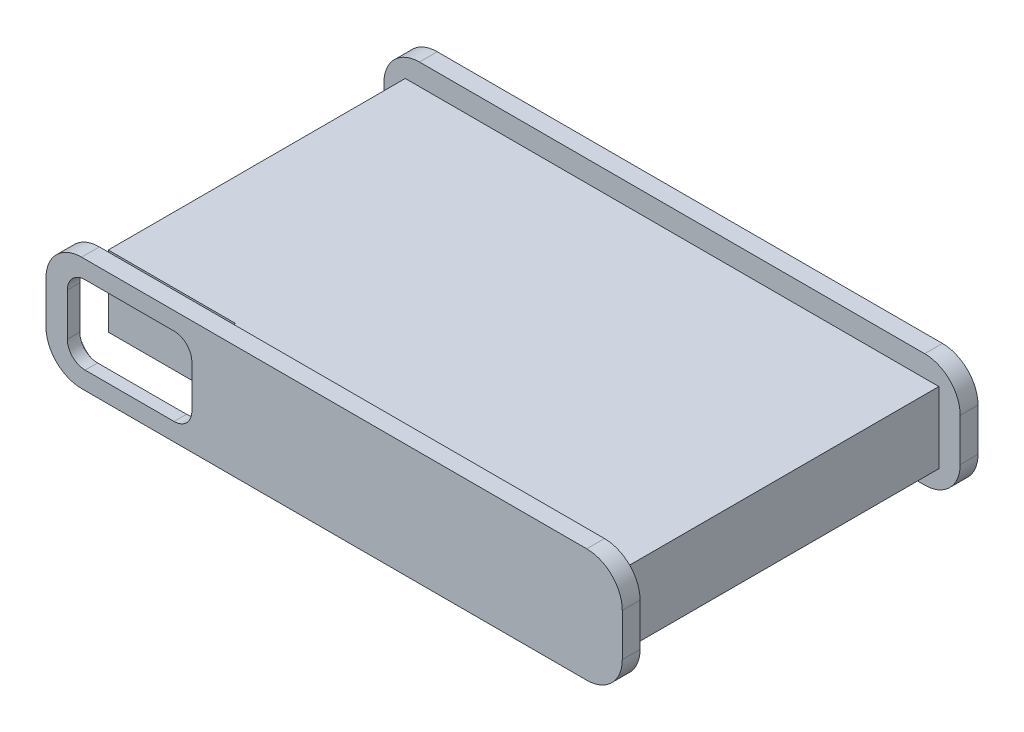
from build123d import *

# Parameters (mm, degrees)
SKETCH1_W           = 150
SKETCH1_H           = 20
BOSS_EXTRUDE1_DEPTH = 90
SKETCH2_W           = 162
SKETCH2_H           = 32
BOSS_EXTRUDE2_DEPTH = 5
FILLET1_R           = 10
FILLET2_R           = 10
FILLET3_R           = 10
FILLET4_R           = 10
BOSS_EXTRUDE3_DEPTH = 5
CUT_EXTRUDE1_DEPTH  = 3.5
CUT_EXTRUDE2_DEPTH  = 8


with BuildPart() as part:
    # Sketch1 → Boss-Extrude1 (new body)
    with BuildSketch(Plane.XY):
        Rectangle(SKETCH1_W, SKETCH1_H)
    extrude(amount=BOSS_EXTRUDE1_DEPTH)

    # Sketch2 → Boss-Extrude2 (add)
    with BuildSketch(Plane(origin=(0, 0, 0), x_dir=(-1, 0, 0), z_dir=(0, 0, -1))):
        Rectangle(SKETCH2_W, SKETCH2_H)
    extrude(amount=BOSS_EXTRUDE2_DEPTH)

    # Fillet1
    fillet1_edges = [part.edges().sort_by_distance(p)[0] for p in [
        (81, 16, -2.5),
    ]]
    fillet(fillet1_edges, radius=FILLET1_R)

    # Fillet2
    fillet2_edges = [part.edges().sort_by_distance(p)[0] for p in [
        (81, -16, -2.5),
    ]]
    fillet(fillet2_edges, radius=FILLET2_R)

    # Fillet3
    fillet3_edges = [part.edges().sort_by_distance(p)[0] for p in [
        (-81, 16, -2.5),
    ]]
    fillet(fillet3_edges, radius=FILLET3_R)

    # Fillet4
    fillet4_edges = [part.edges().sort_by_distance(p)[0] for p in [
        (-81, -16, -2.5),
    ]]
    fillet(fillet4_edges, radius=FILLET4_R)

    # Sketch3 → Boss-Extrude3 (add)
    with BuildSketch(Plane.XY.offset(90)):
        with BuildLine():
            Line((-81, 6), (-81, -6))
            ThreePointArc((-81, -6), (-78.071067812, -13.071067812), (-71, -16))
            Line((-71, -16), (71, -16))
            ThreePointArc((71, -16), (78.071067812, -13.071067812), (81, -6))
            Line((81, -6), (81, 6))
            ThreePointArc((81, 6), (78.071067812, 13.071067812), (71, 16))
            Line((71, 16), (-71, 16))
            ThreePointArc((-71, 16), (-78.071067812, 13.071067812), (-81, 6))
        make_face()
    extrude(amount=BOSS_EXTRUDE3_DEPTH)

    # Sketch4 → Cut-Extrude1 (cut)
    with BuildSketch(Plane.XY.offset(95)):
        with BuildLine():
            Line((-70, -11), (-45, -11))
            ThreePointArc((-45, -11), (-41.464466094, -9.535533906), (-40, -6))
            Line((-40, -6), (-40, 6))
            ThreePointArc((-40, 6), (-41.464466094, 9.535533906), (-45, 11))
            Line((-45, 11), (-70, 11))
            ThreePointArc((-70, 11), (-73.535533906, 9.535533906), (-75, 6))
            Line((-75, 6), (-75, -6))
            ThreePointArc((-75, -6), (-73.535533906, -9.535533906), (-70, -11))
        make_face()
    extrude(amount=-CUT_EXTRUDE1_DEPTH, mode=Mode.SUBTRACT)

    # Sketch5 → Cut-Extrude2 (cut)
    with BuildSketch(Plane.XY.offset(91.5)):
        with BuildLine():
            Line((-77, 6), (-77, -6))
            ThreePointArc((-77, -6), (-74.949747468, -10.949747468), (-70, -13))
            Line((-70, -13), (-45, -13))
            ThreePointArc((-45, -13), (-40.050252532, -10.949747468), (-38, -6))
            Line((-38, -6), (-38, 6))
            ThreePointArc((-38, 6), (-40.050252532, 10.949747468), (-45, 13))
            Line((-45, 13), (-70, 13))
            ThreePointArc((-70, 13), (-74.949747468, 10.949747468), (-77, 6))
        make_face()
    extrude(amount=-CUT_EXTRUDE2_DEPTH, mode=Mode.SUBTRACT)


solid = part.part
